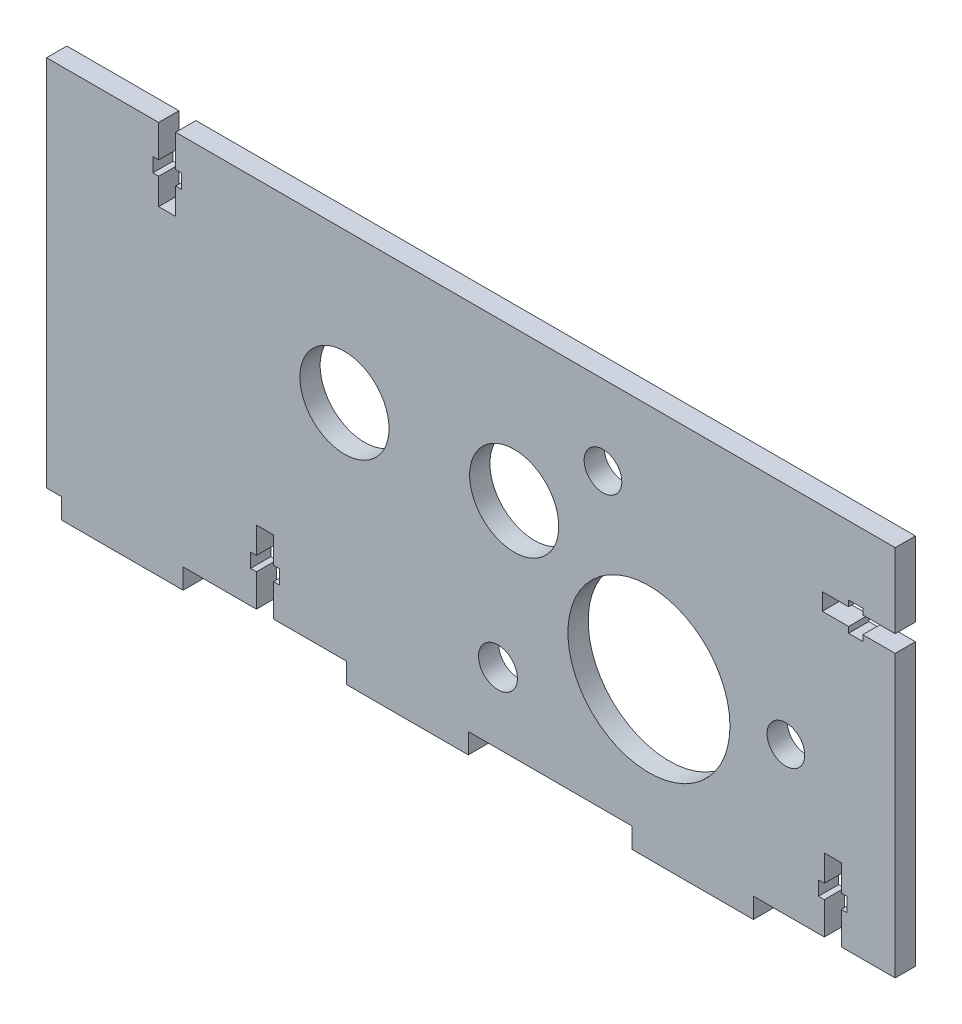
from build123d import *

# Parameters (mm, degrees)
SKETCH1_W           = 230
SKETCH1_H           = 90
BOSS_EXTRUDE1_DEPTH = 5
CUT_EXTRUDE1_REACH  = 125.592
SKETCH2_R           = 11
SKETCH2_R_2         = 16.75
CUT_EXTRUDE2_REACH  = 125.592
SKETCH3_R           = 4.65
SKETCH3_R_2         = 4.8
MOVE_FACE1_BY       = 2
SKETCH5_W           = 20.50990482
SKETCH5_H           = 126.384873773
CUT_EXTRUDE3_DEPTH  = 5
SKETCH6_W           = 30
SKETCH6_H           = 5
BOSS_EXTRUDE3_DEPTH = 5
CUT_EXTRUDE4_DEPTH  = 10
BOSS_EXTRUDE4_DEPTH = 5
SKETCH8_R           = 20
SKETCH8_R_2         = 4.65
SKETCH8_R_3         = 4.8
SKETCH8_R_4         = 11
CUT_EXTRUDE5_DEPTH  = 5


with BuildPart() as part:
    # Sketch1 → Boss-Extrude1 (new body)
    with BuildSketch(Plane.XY):
        Rectangle(SKETCH1_W, SKETCH1_H)
    extrude(amount=BOSS_EXTRUDE1_DEPTH)

    # Sketch2 → Cut-Extrude1 (cut, up to next)
    with BuildSketch(Plane.XY.offset(5), mode=Mode.PRIVATE) as cut_extrude1_sk1:
        with Locations((-20.95, 10)):
            Circle(SKETCH2_R)
    cut_extrude1_tool1 = extrude(cut_extrude1_sk1.sketch, amount=-CUT_EXTRUDE1_REACH, mode=Mode.PRIVATE) & part.part
    # Sketch2 → Cut-Extrude1 (cut, up to next)
    with BuildSketch(Plane.XY.offset(5), mode=Mode.PRIVATE) as cut_extrude1_sk2:
        with Locations((20.95, 10)):
            Circle(SKETCH2_R)
    cut_extrude1_tool2 = extrude(cut_extrude1_sk2.sketch, amount=-CUT_EXTRUDE1_REACH, mode=Mode.PRIVATE) & part.part
    # Sketch2 → Cut-Extrude1 (cut, up to next)
    with BuildSketch(Plane.XY.offset(5), mode=Mode.PRIVATE) as cut_extrude1_sk3:
        with Locations((49.976927154, -10)):
            Circle(SKETCH2_R_2)
    cut_extrude1_tool3 = extrude(cut_extrude1_sk3.sketch, amount=-CUT_EXTRUDE1_REACH, mode=Mode.PRIVATE) & part.part
    add(cut_extrude1_tool1.solids().sort_by_distance((-20.95, 10, 5))[0], mode=Mode.SUBTRACT)
    add(cut_extrude1_tool2.solids().sort_by_distance((20.95, 10, 5))[0], mode=Mode.SUBTRACT)
    add(cut_extrude1_tool3.solids().sort_by_distance((49.976927, -10, 5))[0], mode=Mode.SUBTRACT)

    # Sketch3 → Cut-Extrude2 (cut, up to next)
    with BuildSketch(Plane(origin=(0, 0, 0), x_dir=(-1, 0, 0), z_dir=(0, 0, -1)), mode=Mode.PRIVATE) as cut_extrude2_sk1:
        with Locations((-42.861480484, 27.315297382)):
            Circle(SKETCH3_R)
    cut_extrude2_tool1 = extrude(cut_extrude2_sk1.sketch, amount=-CUT_EXTRUDE2_REACH, mode=Mode.PRIVATE) & part.part
    # Sketch3 → Cut-Extrude2 (cut, up to next)
    with BuildSketch(Plane(origin=(0, 0, 0), x_dir=(-1, 0, 0), z_dir=(0, 0, -1)), mode=Mode.PRIVATE) as cut_extrude2_sk2:
        with Locations((-88.015918911, -8.560303387)):
            Circle(SKETCH3_R)
    cut_extrude2_tool2 = extrude(cut_extrude2_sk2.sketch, amount=-CUT_EXTRUDE2_REACH, mode=Mode.PRIVATE) & part.part
    # Sketch3 → Cut-Extrude2 (cut, up to next)
    with BuildSketch(Plane(origin=(0, 0, 0), x_dir=(-1, 0, 0), z_dir=(0, 0, -1)), mode=Mode.PRIVATE) as cut_extrude2_sk3:
        with Locations((-16.935196723, -27.604446885)):
            Circle(SKETCH3_R_2)
    cut_extrude2_tool3 = extrude(cut_extrude2_sk3.sketch, amount=-CUT_EXTRUDE2_REACH, mode=Mode.PRIVATE) & part.part
    add(cut_extrude2_tool1.solids().sort_by_distance((42.86148, 27.315297, 0))[0], mode=Mode.SUBTRACT)
    add(cut_extrude2_tool2.solids().sort_by_distance((88.015919, -8.560303, 0))[0], mode=Mode.SUBTRACT)
    add(cut_extrude2_tool3.solids().sort_by_distance((16.935197, -27.604447, 0))[0], mode=Mode.SUBTRACT)

    # Move Face1: a face moved outward by 2.0
    extrude(part.faces().sort_by_distance((0, 45, 2.5))[0], amount=MOVE_FACE1_BY, dir=(0, 1, 0))

    # Sketch5 → Cut-Extrude3 (cut)
    with BuildSketch(Plane(origin=(0, 0, 0), x_dir=(-1, 0, 0), z_dir=(0, 0, -1))):
        with Locations((104.74504759, -16.192436887)):
            Rectangle(SKETCH5_W, SKETCH5_H)
    extrude(amount=-CUT_EXTRUDE3_DEPTH, mode=Mode.SUBTRACT)

    # Sketch6 → Boss-Extrude3 (add)
    with BuildSketch(Plane(origin=(0, 0, 0), x_dir=(-1, 0, 0), z_dir=(0, 0, -1))):
        with Locations((5.391218518, -47.5)):
            Rectangle(SKETCH6_W, SKETCH6_H)
        with Locations((75.782437035, -47.5)):
            Rectangle(SKETCH6_W, SKETCH6_H)
        with Locations((-65, -47.5)):
            Rectangle(SKETCH6_W, SKETCH6_H)
    extrude(amount=-BOSS_EXTRUDE3_DEPTH)

    # Sketch7 → Cut-Extrude4 (cut)
    with BuildSketch(Plane.XY.offset(5)):
        Polygon((-42.686827777, -45), (-42.686827777, -37), (-44.136827777, -37), (-44.136827777, -33.5), (-42.686827777, -33.5), (-42.686827777, -27), (-38.486827777, -27), (-38.486827777, -33.5), (-37.036827777, -33.5), (-37.036827777, -37), (-38.486827777, -37), (-38.486827777, -45), align=None)
        Polygon((97.5, -45), (97.5, -37), (96.05, -37), (96.05, -33.5), (97.5, -33.5), (97.5, -27), (101.7, -27), (101.7, -33.5), (103.15, -33.5), (103.15, -37), (101.7, -37), (101.7, -45), align=None)
        Polygon((115, 24.402956743), (107, 24.402956743), (107, 22.952956743), (103.5, 22.952956743), (103.5, 24.402956743), (97, 24.402956743), (97, 28.602956743), (103.5, 28.602956743), (103.5, 30.052956743), (107, 30.052956743), (107, 28.602956743), (115, 28.602956743), align=None)
        Polygon((-62.609520372, 47), (-62.609520372, 39), (-61.159520372, 39), (-61.159520372, 35.5), (-62.609520372, 35.5), (-62.609520372, 29), (-66.809520372, 29), (-66.809520372, 35.5), (-68.259520372, 35.5), (-68.259520372, 39), (-66.809520372, 39), (-66.809520372, 47), align=None)
    extrude(amount=-CUT_EXTRUDE4_DEPTH, mode=Mode.SUBTRACT)

    # Sketch9 → Boss-Extrude4 (add)
    with BuildSketch(Plane.XY.offset(5)):
        Polygon((-39.58489376, 23.410750341), (-37.52309363, -9.578051742), (-6.596091677, -20.917952458), (6.599429156, -35.969093408), (51.752852007, -37.618533512), (87.628174272, -20.917952458), (101.85459517, 0), (47.084922834, 37.249172102), align=None)
    extrude(amount=-BOSS_EXTRUDE4_DEPTH)

    # Sketch8 → Cut-Extrude5 (cut)
    with BuildSketch(Plane.XY.offset(5)):
        with Locations((54.21355411, -11.517627108)):
            Circle(SKETCH8_R)
        with Locations((42.861480484, 27.315297382)):
            Circle(SKETCH8_R_2)
        with Locations((88.015918911, -8.560303387)):
            Circle(SKETCH8_R_2)
        with Locations((16.935196723, -27.604446885)):
            Circle(SKETCH8_R_3)
        with Locations((20.95, 10)):
            Circle(SKETCH8_R_4)
        with Locations((-20.95, 10)):
            Circle(SKETCH8_R_4)
    extrude(amount=-CUT_EXTRUDE5_DEPTH, mode=Mode.SUBTRACT)


solid = part.part
